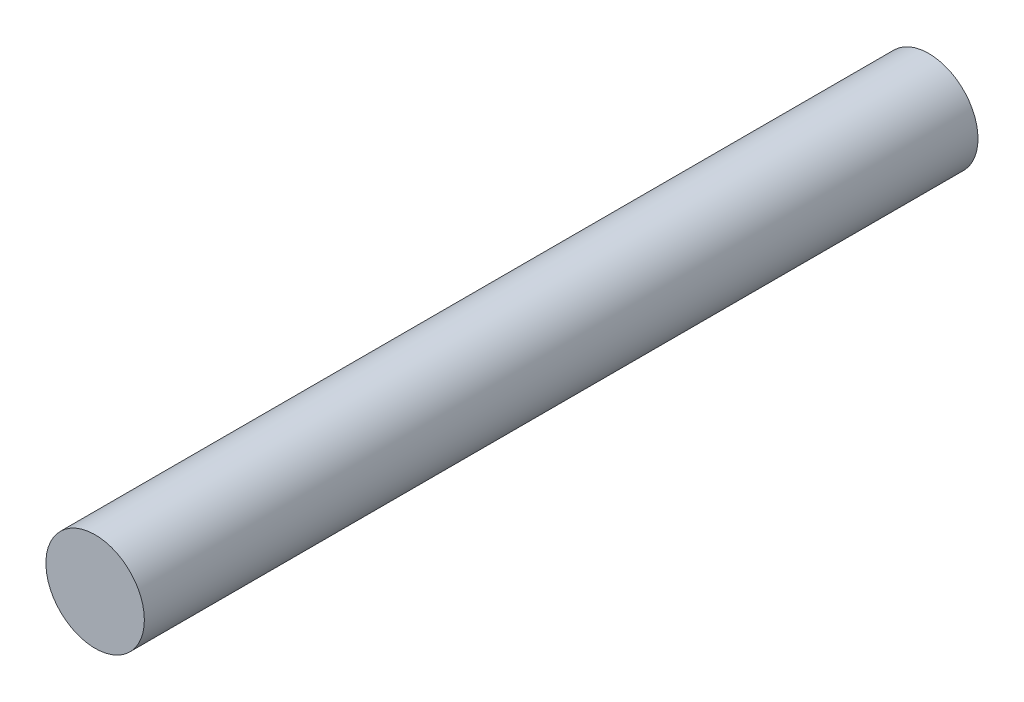
from build123d import *

# Parameters (mm, degrees)
SKETCH1_R           = 3
BOSS_EXTRUDE1_DEPTH = 50.8


with BuildPart() as part:
    # Sketch1 → Boss-Extrude1 (new body)
    with BuildSketch(Plane.XY):
        Circle(SKETCH1_R)
    extrude(amount=BOSS_EXTRUDE1_DEPTH)


solid = part.part
